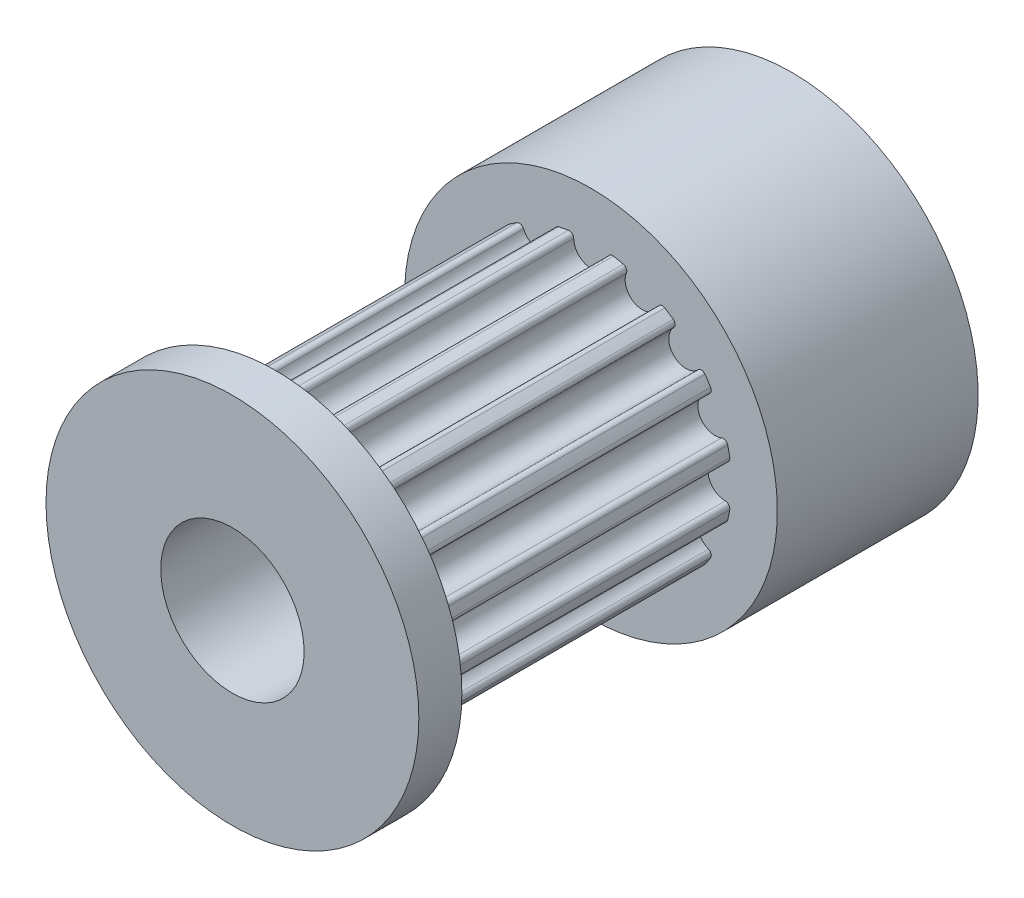
from build123d import *

# Parameters (mm, degrees)
SKETCHREVOLVEGEARBELT01_W       = 11
SKETCHREVOLVEGEARBELT01_H       = 4.902458105
TOOTHEXTRUDECUTGEARBELT01_DEPTH = 5.5
PATTERNGEARBELT01_COUNT         = 16
SKETCH_5_R                      = 6.5
EXTRUDE_1_DEPTH                 = 1.5
EXTRUDE_START                   = 7
SKETCH_6_R                      = 6.5
EXTRUDE_2_DEPTH                 = 7
CUT_EXTRUDE_2_DEPTH             = 16.516120649
CUT_EXTRUDE_2_DEPTH_BACK        = 16.516120649
SKETCH_7_R                      = 2.5


with BuildPart() as part:
    # SketchRevolveGearBelt01 → GearBelt01 (revolve)
    with BuildSketch(Plane(origin=(0, 0, 0), x_dir=(0, 0, -1), z_dir=(1, 0, 0))):
        with Locations((0, 2.451229053)):
            Rectangle(SKETCHREVOLVEGEARBELT01_W, SKETCHREVOLVEGEARBELT01_H)
    revolve(axis=Axis((0, 0, 5.5), (0, 0, -1)))

    # SketchToothGearBelt01 → ToothExtrudeCutGearBelt01 (cut, symmetric)
    with BuildSketch(Plane.XY):
        with BuildLine():
            Line((-0.783301597, 4.839476633), (0, 7.442458067))
            Line((0, 7.442458067), (0.783301597, 4.839476633))
            ThreePointArc((0.783301597, 4.839476633), (0.655607945, 4.803813062), (0.599999991, 4.683458109))
            ThreePointArc((0.599999991, 4.683458109), (0, 4.083458118), (-0.599999991, 4.683458109))
            ThreePointArc((-0.599999991, 4.683458109), (-0.655607945, 4.803813062), (-0.783301597, 4.839476633))
        make_face()
    toothextrudecutgearbelt01 = extrude(amount=TOOTHEXTRUDECUTGEARBELT01_DEPTH, both=True, mode=Mode.SUBTRACT)

    # PatternGearBelt01: ToothExtrudeCutGearBelt01 ×16 about axis
    patterngearbelt01_axis = Axis((0, 0, 55), (0, 0, -1))
    for i in range(1, PATTERNGEARBELT01_COUNT):
        add(toothextrudecutgearbelt01.rotate(patterngearbelt01_axis, i * 360 / PATTERNGEARBELT01_COUNT), mode=Mode.SUBTRACT)

    # Эскиз5 → Бобышка-Вытянуть1 (add)
    with BuildSketch(Plane.XY.offset(5.5)):
        Circle(SKETCH_5_R)
    extrude(amount=EXTRUDE_1_DEPTH)

    # Эскиз6 → Бобышка-Вытянуть2 (add)
    with BuildSketch(Plane(origin=(0, 0, -5.5), x_dir=(-1, 0, 0), z_dir=(0, 0, -1)).offset(EXTRUDE_START)):
        Circle(SKETCH_6_R)
    extrude(amount=-EXTRUDE_2_DEPTH)

    # Эскиз7 → Вырез-Вытянуть2 (cut, two sides: drawn at the far end of the back side and taken through both)
    with BuildSketch(Plane.XY.offset(-CUT_EXTRUDE_2_DEPTH_BACK)):
        Circle(SKETCH_7_R)
    extrude(amount=CUT_EXTRUDE_2_DEPTH + CUT_EXTRUDE_2_DEPTH_BACK, mode=Mode.SUBTRACT)


solid = part.part
